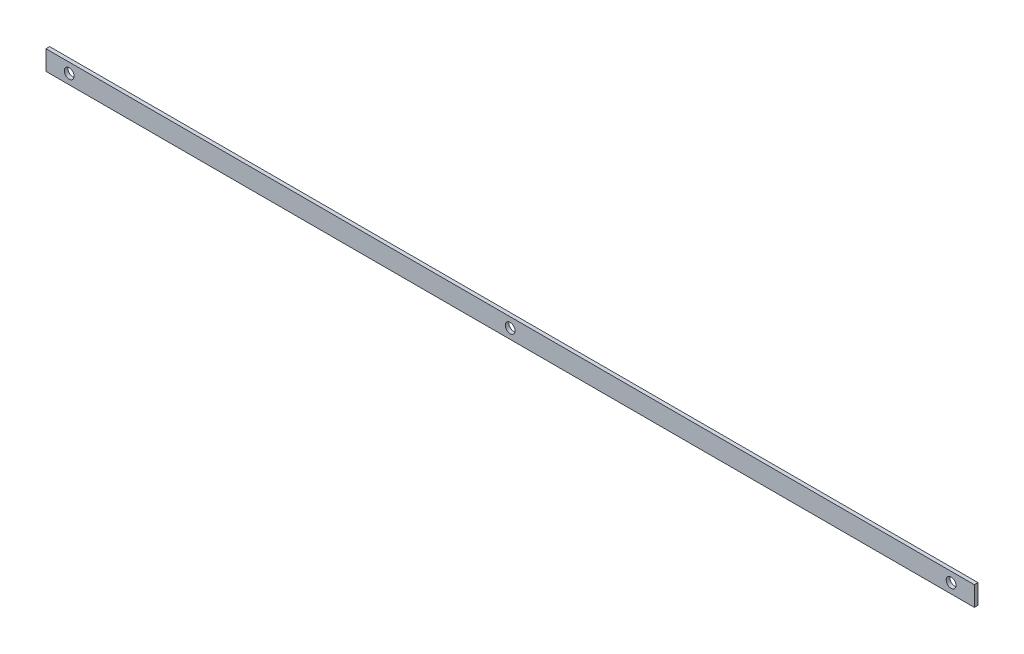
from build123d import *

# Parameters (mm, degrees)
CROQUIS1_W              = 2400
CROQUIS1_H              = 50.8
SALIENTE_EXTRUIR1_DEPTH = 9.525
CROQUIS2_R              = 12.7
CORTAR_EXTRUIR1_DEPTH   = 20


with BuildPart() as part:
    # Croquis1 → Saliente-Extruir1 (new body)
    with BuildSketch(Plane.XY):
        with Locations((1200, -25.4)):
            Rectangle(CROQUIS1_W, CROQUIS1_H)
    extrude(amount=SALIENTE_EXTRUIR1_DEPTH)

    # Croquis2 → Cortar-Extruir1 (cut)
    with BuildSketch(Plane.XY.offset(9.525)):
        with Locations((60, -25.4)):
            Circle(CROQUIS2_R)
        with Locations((2340, -25.4)):
            Circle(CROQUIS2_R)
        with Locations((1200, -25.4)):
            Circle(CROQUIS2_R)
    extrude(amount=-CORTAR_EXTRUIR1_DEPTH, mode=Mode.SUBTRACT)


solid = part.part
